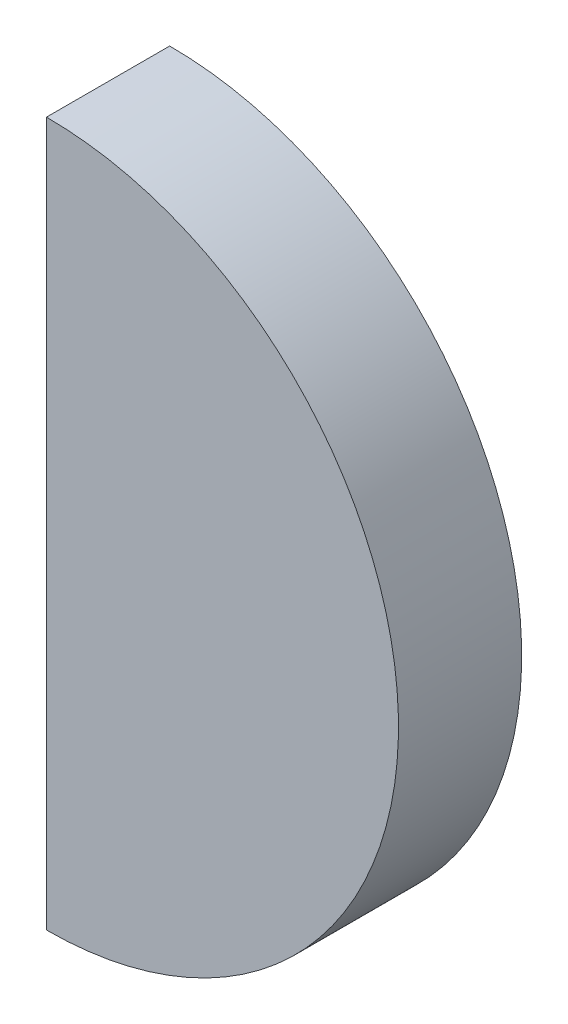
from build123d import *

# Parameters (mm, degrees)
BOSS_EXTRU_1_DEPTH = 70


with BuildPart() as part:
    # Esquisse1 → Boss.-Extru.1 (new body)
    with BuildSketch(Plane.XY):
        with BuildLine():
            ThreePointArc((200, 0), (141.421356237, 141.421356237), (0, 200))
            Line((0, 200), (0, -200))
            ThreePointArc((0, -200), (141.421356237, -141.421356237), (200, 0))
        make_face()
    extrude(amount=BOSS_EXTRU_1_DEPTH)


solid = part.part
